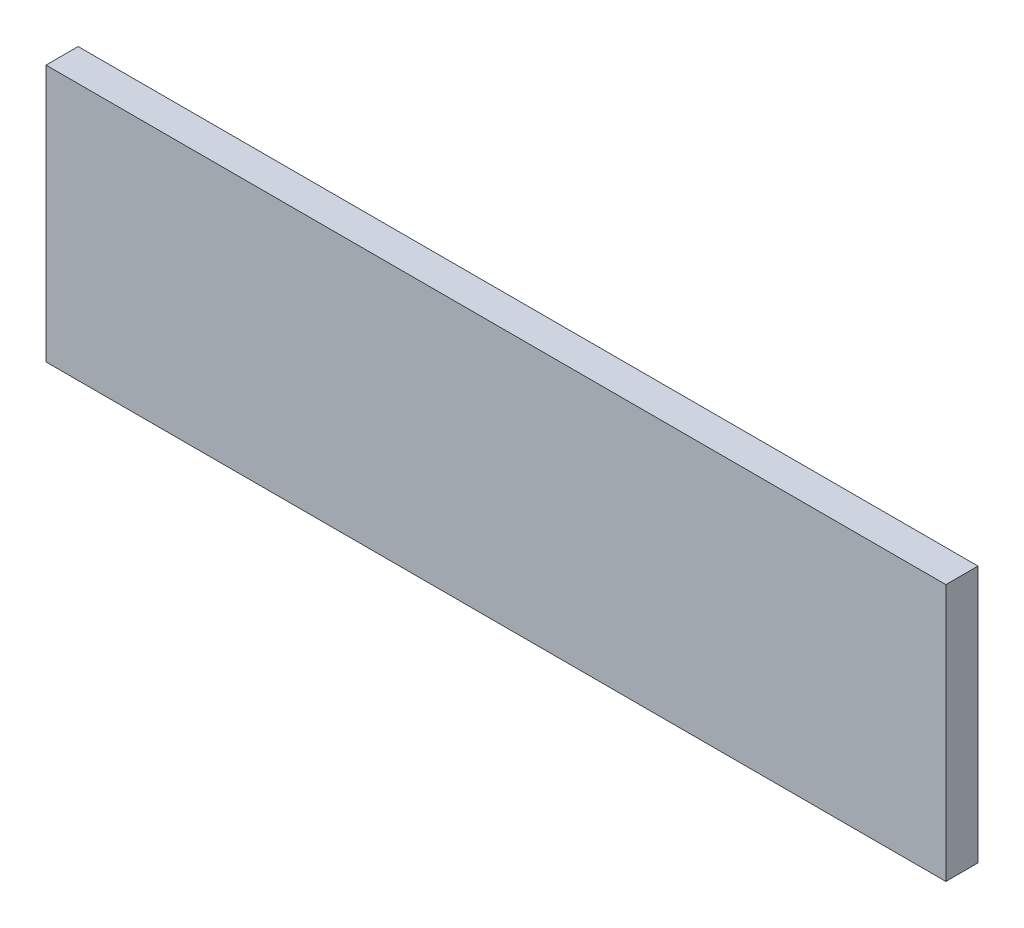
from build123d import *

# Parameters (mm, degrees)
ESQUISSE1_W        = 355.6
ESQUISSE1_H        = 101.6
BOSS_EXTRU_1_DEPTH = 12.7


with BuildPart() as part:
    # Esquisse1 → Boss.-Extru.1 (new body)
    with BuildSketch(Plane.XY):
        with Locations((177.8, 50.8)):
            Rectangle(ESQUISSE1_W, ESQUISSE1_H)
    extrude(amount=-BOSS_EXTRU_1_DEPTH)


solid = part.part
